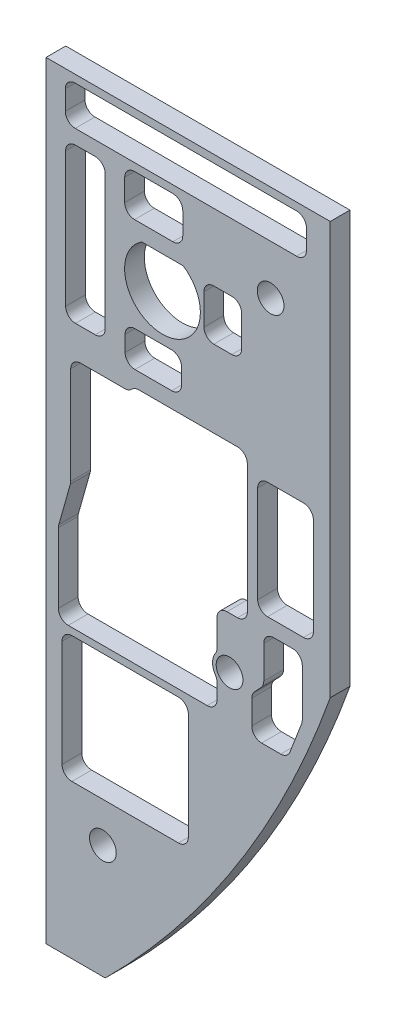
from build123d import *

# Parameters (mm, degrees)
SKETCH1_R             = 1.190050877
BOSS_EXTRUDE1_DEPTH   = 3.175
CUT_EXTRUDE1_DEPTH    = 101.879307291
SKETCH12_W            = 19.05
SKETCH12_H            = 23.8125
CUT_EXTRUDE2_DEPTH    = 149.534698577
SKETCH17_W            = 20.32
SKETCH17_H            = 20.32
CUT_EXTRUDE3_DEPTH    = 149.534698577
FILLET1_R             = 1.5875
F_6_CLEARANCE_HOLE1_D = 4.3053
CUT_EXTRUDE4_DEPTH    = 149.534698577
FILLET3_R             = 1.5875


with BuildPart() as part:
    # Sketch1 → Boss-Extrude1 (new body)
    with BuildSketch(Plane.XY):
        with BuildLine():
            Line((0, -17.78), (0, -141.2875))
            Line((0, -141.2875), (9.525, -141.2875))
            ThreePointArc((9.525, -141.2875), (30.833523511, -114.746148224), (45.72, -84.1375))
            Line((45.72, -84.1375), (45.72, -17.78))
            Line((45.72, -17.78), (0, -17.78))
        make_face()
        with Locations((18.7325, -40.894)):
            Circle(SKETCH1_R, mode=Mode.SUBTRACT)
    extrude(amount=-BOSS_EXTRUDE1_DEPTH)

    # Sketch11 → Cut-Extrude1 (cut, through all)
    with BuildSketch(Plane(origin=(20.844780046, -43.574770805, 0), x_dir=(1, 0, 0), z_dir=(0, 0, 1))):
        with BuildLine():
            Line((-5.443361979, 7.786170805), (1.218801886, 7.786170805))
            ThreePointArc((1.218801886, 7.786170805), (-2.112280046, -3.415229195), (-5.443361979, 7.786170805))
        make_face()
    extrude(amount=-CUT_EXTRUDE1_DEPTH, mode=Mode.SUBTRACT)

    # Sketch12 → Cut-Extrude2 (cut, through all)
    with BuildSketch(Plane.XY):
        with Locations((22.86, -68.54825)):
            Rectangle(SKETCH12_W, SKETCH12_H)
    extrude(amount=-CUT_EXTRUDE2_DEPTH, mode=Mode.SUBTRACT)

    # Sketch17 → Cut-Extrude3 (cut, through all)
    with BuildSketch(Plane.XY):
        with Locations((12.731722108, -106.422544949)):
            Rectangle(SKETCH17_W, SKETCH17_H)
    extrude(amount=-CUT_EXTRUDE3_DEPTH, mode=Mode.SUBTRACT)

    # Fillet1
    fillet1_edges = [part.edges().sort_by_distance(p)[0] for p in [
        (13.335, -80.4545, -1.5875),
        (13.335, -56.642, -1.5875),
        (32.385, -56.642, -1.5875),
        (32.385, -80.4545, -1.5875),
        (22.891722108, -96.262544949, -1.5875),
        (22.891722108, -116.582544949, -1.5875),
        (2.571722108, -116.582544949, -1.5875),
        (2.571722108, -96.262544949, -1.5875),
    ]]
    fillet(fillet1_edges, radius=FILLET1_R)

    # #6 Clearance Hole1 (through all)
    with Locations(Plane.XY):
        with Locations((9.144, -122.9995), (29.5275, -88.7095), (36.1315, -33.274)):
            Hole(F_6_CLEARANCE_HOLE1_D / 2)

    # Sketch20 → Cut-Extrude4 (cut, through all)
    with BuildSketch(Plane.XY):
        with BuildLine():
            Line((1.9875505, -93.544142926), (1.9875505, -82.303444681))
            ThreePointArc((1.9875505, -82.303444681), (2.002594465, -82.085411961), (2.04744123, -81.871511621))
            Line((2.04744123, -81.871511621), (3.907011168, -75.294806703))
            ThreePointArc((3.907011168, -75.294806703), (3.951857933, -75.080906363), (3.966901898, -74.862873644))
            Line((3.966901898, -74.862873644), (3.966901898, -59.18890883))
            ThreePointArc((3.966901898, -59.18890883), (4.431869883, -58.066376815), (5.554401898, -57.60140883))
            Line((5.554401898, -57.60140883), (9.117080567, -57.60140883))
            Line((9.117080567, -57.60140883), (27.511016487, -57.60140883))
            Line((27.511016487, -57.60140883), (27.511016487, -86.314118515))
            ThreePointArc((27.511016487, -86.314118515), (27.442924116, -86.774071456), (27.244488351, -87.194567028))
            ThreePointArc((27.244488351, -87.194567028), (26.786216014, -88.708422955), (27.244488351, -90.222278881))
            ThreePointArc((27.244488351, -90.222278881), (27.442924116, -90.642774454), (27.511016487, -91.102727395))
            Line((27.511016487, -91.102727395), (27.511016487, -93.544142926))
            ThreePointArc((27.511016487, -93.544142926), (27.046048502, -94.666674941), (25.923516487, -95.131642926))
            Line((25.923516487, -95.131642926), (3.5750505, -95.131642926))
            ThreePointArc((3.5750505, -95.131642926), (2.452518485, -94.666674941), (1.9875505, -93.544142926))
        make_face()
        with BuildLine():
            Line((39.239705373, -94.952090373), (41.119480948, -90.066805962))
            ThreePointArc((41.119480948, -90.066805962), (41.19867933, -89.78663398), (41.225378141, -89.49671003))
            Line((41.225378141, -89.49671003), (41.225378141, -81.903016886))
            ThreePointArc((41.225378141, -81.903016886), (40.760410156, -80.780484871), (39.637878141, -80.315516886))
            Line((39.637878141, -80.315516886), (36.61477648, -80.315516886))
            ThreePointArc((36.61477648, -80.315516886), (35.492244465, -80.780484871), (35.02727648, -81.903016886))
            Line((35.02727648, -81.903016886), (35.02727648, -87.180260326))
            ThreePointArc((35.02727648, -87.180260326), (34.917248136, -87.760978637), (34.602415054, -88.261198713))
            Line((34.602415054, -88.261198713), (33.520520126, -89.424866126))
            ThreePointArc((33.520520126, -89.424866126), (33.205687045, -89.925086202), (33.095658701, -90.505804513))
            Line((33.095658701, -90.505804513), (33.095658701, -94.381994441))
            ThreePointArc((33.095658701, -94.381994441), (33.560626686, -95.504526456), (34.683158701, -95.969494441))
            Line((34.683158701, -95.969494441), (37.758102566, -95.969494441))
            ThreePointArc((37.758102566, -95.969494441), (38.65674848, -95.690654737), (39.239705373, -94.952090373))
        make_face()
        with BuildLine():
            Line((20.217000424, -54.116093897), (14.306430977, -54.116093897))
            ThreePointArc((14.306430977, -54.116093897), (13.183898962, -53.651125912), (12.718930977, -52.528593897))
            Line((12.718930977, -52.528593897), (12.718930977, -50.013735278))
            ThreePointArc((12.718930977, -50.013735278), (13.183898962, -48.891203263), (14.306430977, -48.426235278))
            Line((14.306430977, -48.426235278), (20.217000424, -48.426235278))
            ThreePointArc((20.217000424, -48.426235278), (21.339532439, -48.891203263), (21.804500424, -50.013735278))
            Line((21.804500424, -50.013735278), (21.804500424, -52.528593897))
            ThreePointArc((21.804500424, -52.528593897), (21.339532439, -53.651125912), (20.217000424, -54.116093897))
        make_face()
        with BuildLine():
            Line((29.885101261, -44.237571754), (26.996152875, -44.237571754))
            ThreePointArc((26.996152875, -44.237571754), (25.87362086, -43.772603769), (25.408652875, -42.650071754))
            Line((25.408652875, -42.650071754), (25.408652875, -37.714249524))
            ThreePointArc((25.408652875, -37.714249524), (25.87362086, -36.591717509), (26.996152875, -36.126749524))
            Line((26.996152875, -36.126749524), (29.885101261, -36.126749524))
            ThreePointArc((29.885101261, -36.126749524), (31.007633276, -36.591717509), (31.472601261, -37.714249524))
            Line((31.472601261, -37.714249524), (31.472601261, -42.650071754))
            ThreePointArc((31.472601261, -42.650071754), (31.007633276, -43.772603769), (29.885101261, -44.237571754))
        make_face()
        with BuildLine():
            Line((20.406928746, -33.259078247), (14.243980141, -33.259078247))
            ThreePointArc((14.243980141, -33.259078247), (13.121448126, -32.794110262), (12.656480141, -31.671578247))
            Line((12.656480141, -31.671578247), (12.656480141, -28.136425111))
            ThreePointArc((12.656480141, -28.136425111), (13.121448126, -27.013893096), (14.243980141, -26.548925111))
            Line((14.243980141, -26.548925111), (20.406928746, -26.548925111))
            ThreePointArc((20.406928746, -26.548925111), (21.529460761, -27.013893096), (21.994428746, -28.136425111))
            Line((21.994428746, -28.136425111), (21.994428746, -31.671578247))
            ThreePointArc((21.994428746, -31.671578247), (21.529460761, -32.794110262), (20.406928746, -33.259078247))
        make_face()
        with BuildLine():
            Line((9.51166577, -50.881662937), (9.51166577, -29.220981566))
            ThreePointArc((9.51166577, -29.220981566), (9.046697786, -28.098449551), (7.92416577, -27.633481566))
            Line((7.92416577, -27.633481566), (4.736850702, -27.633481566))
            ThreePointArc((4.736850702, -27.633481566), (3.614318687, -28.098449551), (3.149350702, -29.220981566))
            Line((3.149350702, -29.220981566), (3.149350702, -50.881662937))
            ThreePointArc((3.149350702, -50.881662937), (3.614318687, -52.004194952), (4.736850702, -52.469162937))
            Line((4.736850702, -52.469162937), (7.92416577, -52.469162937))
            ThreePointArc((7.92416577, -52.469162937), (9.046697786, -52.004194952), (9.51166577, -50.881662937))
        make_face()
        with BuildLine():
            Line((40.313091041, -25.321573057), (4.684667753, -25.321573057))
            ThreePointArc((4.684667753, -25.321573057), (3.562135738, -24.856605072), (3.097167753, -23.734073057))
            Line((3.097167753, -23.734073057), (3.097167753, -20.606442704))
            ThreePointArc((3.097167753, -20.606442704), (3.562135738, -19.483910688), (4.684667753, -19.018942704))
            Line((4.684667753, -19.018942704), (40.313091041, -19.018942704))
            ThreePointArc((40.313091041, -19.018942704), (41.435623056, -19.483910688), (41.900591041, -20.606442704))
            Line((41.900591041, -20.606442704), (41.900591041, -23.734073057))
            ThreePointArc((41.900591041, -23.734073057), (41.435623056, -24.856605072), (40.313091041, -25.321573057))
        make_face()
        with BuildLine():
            Line((43.01404737, -76.302416551), (43.01404737, -60.74025149))
            ThreePointArc((43.01404737, -60.74025149), (42.549079385, -59.617719475), (41.42654737, -59.15275149))
            Line((41.42654737, -59.15275149), (35.637827713, -59.15275149))
            ThreePointArc((35.637827713, -59.15275149), (34.515295697, -59.617719475), (34.050327713, -60.74025149))
            Line((34.050327713, -60.74025149), (34.050327713, -76.302416551))
            ThreePointArc((34.050327713, -76.302416551), (34.515295697, -77.424948566), (35.637827713, -77.889916551))
            Line((35.637827713, -77.889916551), (41.42654737, -77.889916551))
            ThreePointArc((41.42654737, -77.889916551), (42.549079385, -77.424948566), (43.01404737, -76.302416551))
        make_face()
    extrude(amount=-CUT_EXTRUDE4_DEPTH, mode=Mode.SUBTRACT)

    # Fillet3
    fillet3_edges = [part.edges().sort_by_distance(p)[0] for p in [
        (13.464536443, -57.60140883, -1.5875),
        (27.511016487, -80.4545, -1.5875),
    ]]
    fillet(fillet3_edges, radius=FILLET3_R)


solid = part.part
